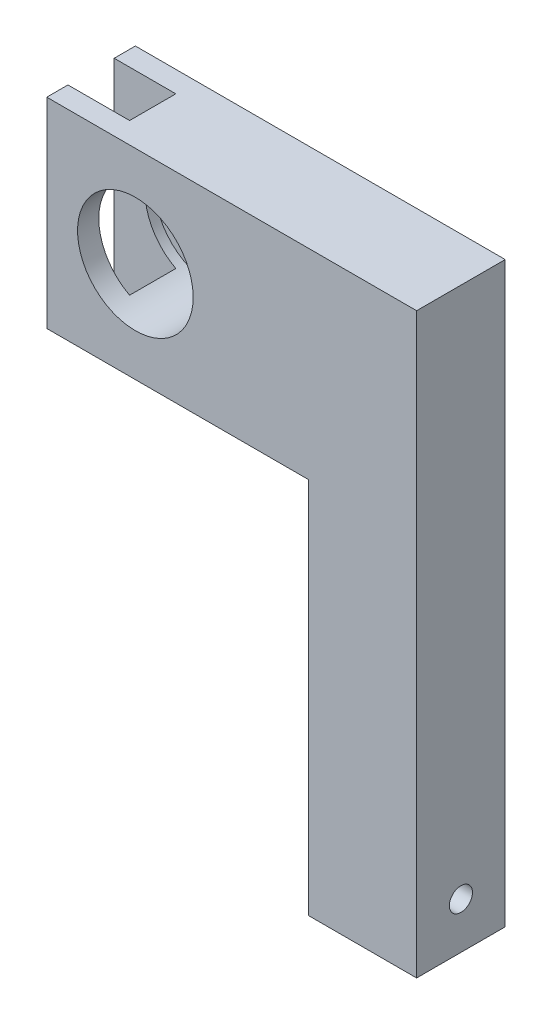
from build123d import *

# Parameters (mm, degrees)
SKETCH1_R           = 15
BOSS_EXTRUDE1_DEPTH = 23
SKETCH1_3_R         = 15
SKETCH1_3_R_2       = 6
BOSS_EXTRUDE2_DEPTH = 3
CUT_EXTRUDE1_REACH  = 181.569
SKETCH2_W           = 16
SKETCH2_H           = 12
CUT_EXTRUDE2_REACH  = 181.569
SKETCH3_R           = 3


with BuildPart() as part:
    # Sketch1 → Boss-Extrude1 (new body)
    with BuildSketch(Plane.XY):
        Polygon((0, 98), (68, 98), (68, 0), (96, 0), (96, 150), (0, 150), align=None)
        with Locations((23, 124)):
            Circle(SKETCH1_R, mode=Mode.SUBTRACT)
    extrude(amount=BOSS_EXTRUDE1_DEPTH)

    # Sketch1<3> → Boss-Extrude2 (add)
    with BuildSketch(Plane.XY):
        with Locations((23, 124)):
            Circle(SKETCH1_3_R)
        with Locations((23, 124)):
            Circle(SKETCH1_3_R_2, mode=Mode.SUBTRACT)
    extrude(amount=BOSS_EXTRUDE2_DEPTH)

    # Sketch2 → Cut-Extrude1 (cut, up to next)
    with BuildSketch(Plane(origin=(0, 150, 0), x_dir=(1, 0, 0), z_dir=(0, 1, 0)), mode=Mode.PRIVATE) as cut_extrude1_sk1:
        with Locations((8, -11.5)):
            Rectangle(SKETCH2_W, SKETCH2_H)
    cut_extrude1_tool1 = extrude(cut_extrude1_sk1.sketch, amount=-CUT_EXTRUDE1_REACH, mode=Mode.PRIVATE) & part.part
    add(cut_extrude1_tool1.solids().sort_by_distance((8, 150, 11.5))[0], mode=Mode.SUBTRACT)

    # Sketch3 → Cut-Extrude2 (cut, up to next)
    with BuildSketch(Plane(origin=(96, 0, 0), x_dir=(0, 0, -1), z_dir=(1, 0, 0)), mode=Mode.PRIVATE) as cut_extrude2_sk1:
        with Locations((-11.5, 12)):
            Circle(SKETCH3_R)
    cut_extrude2_tool1 = extrude(cut_extrude2_sk1.sketch, amount=-CUT_EXTRUDE2_REACH, mode=Mode.PRIVATE) & part.part
    add(cut_extrude2_tool1.solids().sort_by_distance((96, 12, 11.5))[0], mode=Mode.SUBTRACT)


solid = part.part
